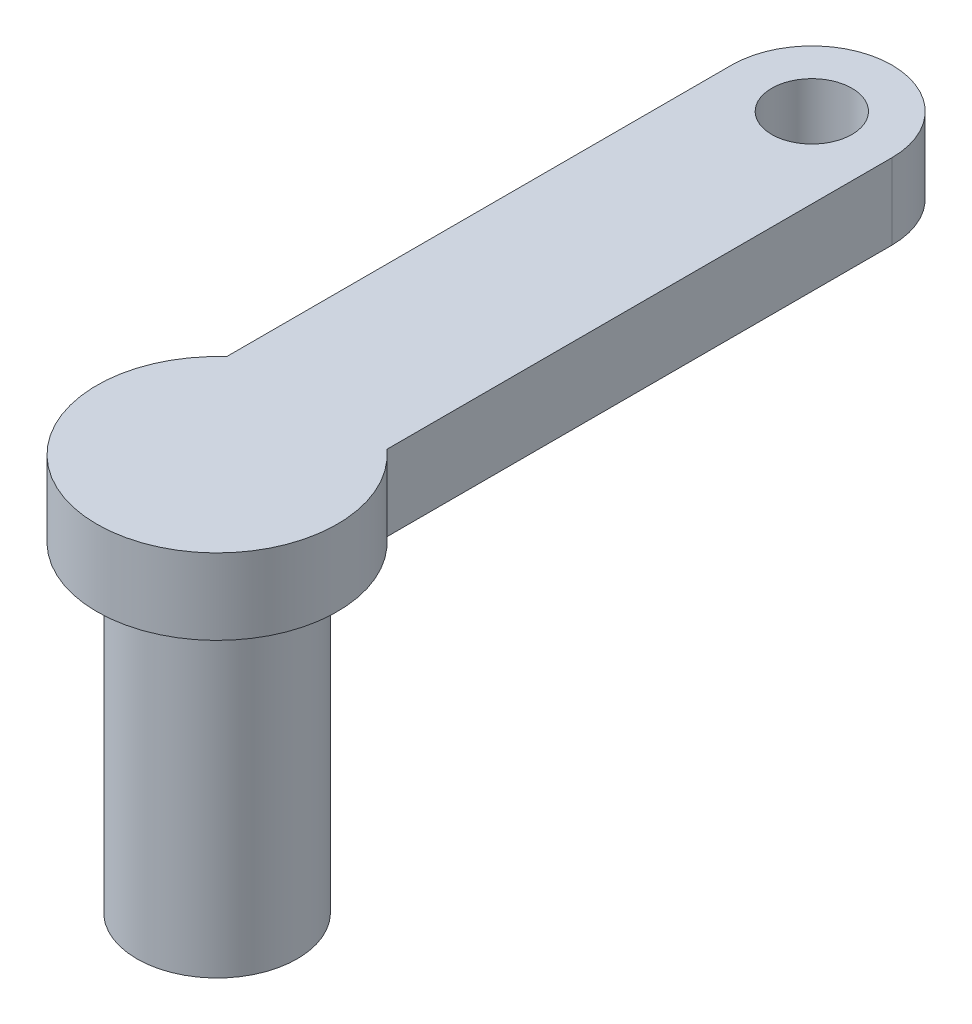
from build123d import *

# Parameters (mm, degrees)
SKETCH1_R           = 19.84375
BOSS_EXTRUDE1_DEPTH = 37.5
SKETCH2_R           = 39.6875
BOSS_EXTRUDE2_DEPTH = 158.75


with BuildPart() as part:
    # Sketch1 → Boss-Extrude1 (new body)
    with BuildSketch(Plane(origin=(0, 0, 0), x_dir=(1, 0, 0), z_dir=(0, 1, 0))):
        with BuildLine():
            Line((-39.6875, 44.371973929), (-39.6875, 294.371973929))
            ThreePointArc((-39.6875, 294.371973929), (0, 334.059473929), (39.6875, 294.371973929))
            Line((39.6875, 294.371973929), (39.6875, 44.371973929))
            ThreePointArc((39.6875, 44.371973929), (0, -59.53125), (-39.6875, 44.371973929))
        make_face()
        with Locations(Location((0, 294.371973929, 0), (0, 0, 270))):
            Circle(SKETCH1_R, mode=Mode.SUBTRACT)
    extrude(amount=BOSS_EXTRUDE1_DEPTH)

    # Sketch2 → Boss-Extrude2 (add)
    with BuildSketch(Plane.XZ):
        with Locations(Location((0, 0, 0), (0, 0, 90))):
            Circle(SKETCH2_R)
    extrude(amount=BOSS_EXTRUDE2_DEPTH)


solid = part.part
